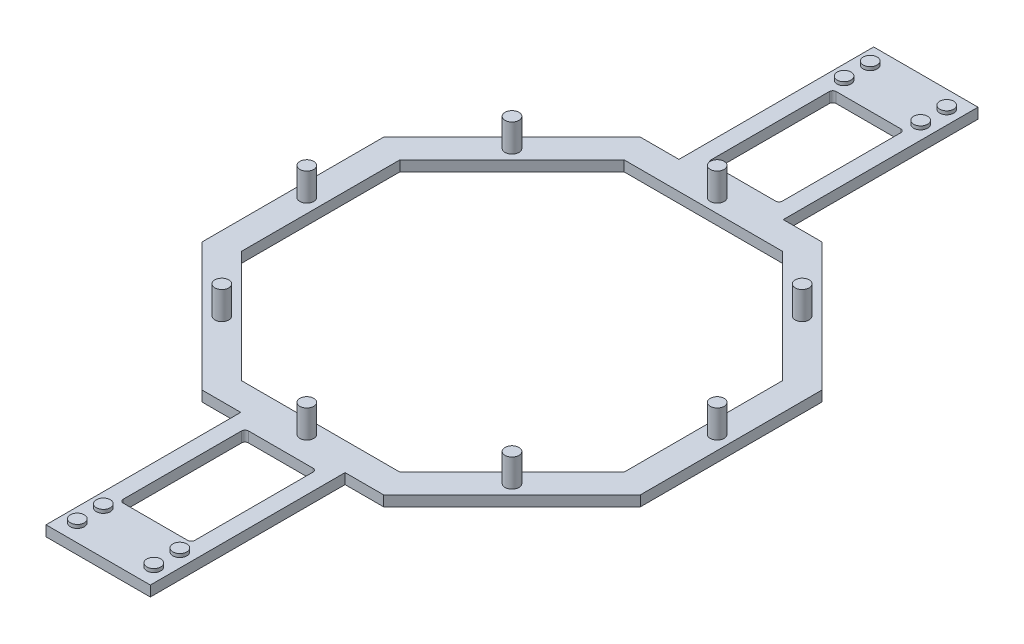
from build123d import *

# Parameters (mm, degrees)
BOSS_EXTRUDE1_DEPTH = 3
SKETCH3_R           = 2
BOSS_EXTRUDE4_DEPTH = 1
SKETCH5_R           = 2
BOSS_EXTRUDE8_DEPTH = 11


with BuildPart() as part:
    # Sketch2 → Boss-Extrude1 (new body)
    with BuildSketch(Plane(origin=(0, 0, 0), x_dir=(1, 0, 0), z_dir=(0, 1, 0))):
        Polygon((15, -119), (15, -63), (26.09545443, -63), (63, -26.09545443), (63, 26.09545443), (26.09545443, 63), (15, 63), (15, 119), (-15, 119), (-15, 63), (-26.09545443, 63), (-63, 26.09545443), (-63, -26.09545443), (-26.09545443, -63), (-15, -63), (-15, -119), align=None)
        with BuildLine():
            ThreePointArc((-9.27, 102.507028553), (-9.977106781, 102.214135334), (-10.27, 101.507028553))
            Line((-10.27, 101.507028553), (-10.27, 67.507028553))
            ThreePointArc((-10.27, 67.507028553), (-9.977106781, 66.799921772), (-9.27, 66.507028553))
            Line((-9.27, 66.507028553), (9.27, 66.507028553))
            ThreePointArc((9.27, 66.507028553), (9.977106781, 66.799921772), (10.27, 67.507028553))
            Line((10.27, 67.507028553), (10.27, 101.507028553))
            ThreePointArc((10.27, 101.507028553), (9.977106781, 102.214135334), (9.27, 102.507028553))
            Line((9.27, 102.507028553), (-9.27, 102.507028553))
        make_face(mode=Mode.SUBTRACT)
        with BuildLine():
            ThreePointArc((-10.27, -101.507028553), (-9.977106781, -102.214135334), (-9.27, -102.507028553))
            Line((-9.27, -102.507028553), (9.27, -102.507028553))
            ThreePointArc((9.27, -102.507028553), (9.977106781, -102.214135334), (10.27, -101.507028553))
            Line((10.27, -101.507028553), (10.27, -67.507028553))
            ThreePointArc((10.27, -67.507028553), (9.977106781, -66.799921772), (9.27, -66.507028553))
            Line((9.27, -66.507028553), (-9.27, -66.507028553))
            ThreePointArc((-9.27, -66.507028553), (-9.977106781, -66.799921772), (-10.27, -67.507028553))
            Line((-10.27, -67.507028553), (-10.27, -101.507028553))
        make_face(mode=Mode.SUBTRACT)
        Polygon((-22.781745931, -55), (22.781745931, -55), (55, -22.781745931), (55, 22.781745931), (22.781745931, 55), (-22.781745931, 55), (-55, 22.781745931), (-55, -22.781745931), align=None, mode=Mode.SUBTRACT)
    extrude(amount=BOSS_EXTRUDE1_DEPTH)

    # Sketch3 → Boss-Extrude4 (add)
    with BuildSketch(Plane(origin=(0, 3, 0), x_dir=(1, 0, 0), z_dir=(0, 1, 0))):
        with Locations(Location((-11, 114, 0), (0, 0, 270))):
            Circle(SKETCH3_R)
        with Locations(Location((-11, 106.5, 0), (0, 0, 270))):
            Circle(SKETCH3_R)
        with Locations(Location((11, 114, 0), (0, 0, 270))):
            Circle(SKETCH3_R)
        with Locations(Location((11, 106.5, 0), (0, 0, 270))):
            Circle(SKETCH3_R)
        with Locations(Location((11, -114, 0), (0, 0, 270))):
            Circle(SKETCH3_R)
        with Locations(Location((-11, -114, 0), (0, 0, 270))):
            Circle(SKETCH3_R)
        with Locations(Location((-11, -106.5, 0), (0, 0, 270))):
            Circle(SKETCH3_R)
        with Locations(Location((11, -106.5, 0), (0, 0, 270))):
            Circle(SKETCH3_R)
    extrude(amount=BOSS_EXTRUDE4_DEPTH)

    # Sketch5 → Boss-Extrude8 (add)
    with BuildSketch(Plane(origin=(0, 0, 0), x_dir=(1, 0, 0), z_dir=(0, 1, 0))):
        with Locations(Location((0, 59, 0), (0, 0, 270))):
            Circle(SKETCH5_R)
        with Locations(Location((41.71930009, 41.71930009, 0), (0, 0, 270))):
            Circle(SKETCH5_R)
        with Locations(Location((59, 0, 0), (0, 0, 270))):
            Circle(SKETCH5_R)
        with Locations(Location((41.71930009, -41.71930009, 0), (0, 0, 270))):
            Circle(SKETCH5_R)
        with Locations(Location((0, -59, 0), (0, 0, 270))):
            Circle(SKETCH5_R)
        with Locations(Location((-41.71930009, -41.71930009, 0), (0, 0, 270))):
            Circle(SKETCH5_R)
        with Locations(Location((-59, 0, 0), (0, 0, 270))):
            Circle(SKETCH5_R)
        with Locations(Location((-41.71930009, 41.71930009, 0), (0, 0, 270))):
            Circle(SKETCH5_R)
    extrude(amount=BOSS_EXTRUDE8_DEPTH)


solid = part.part
